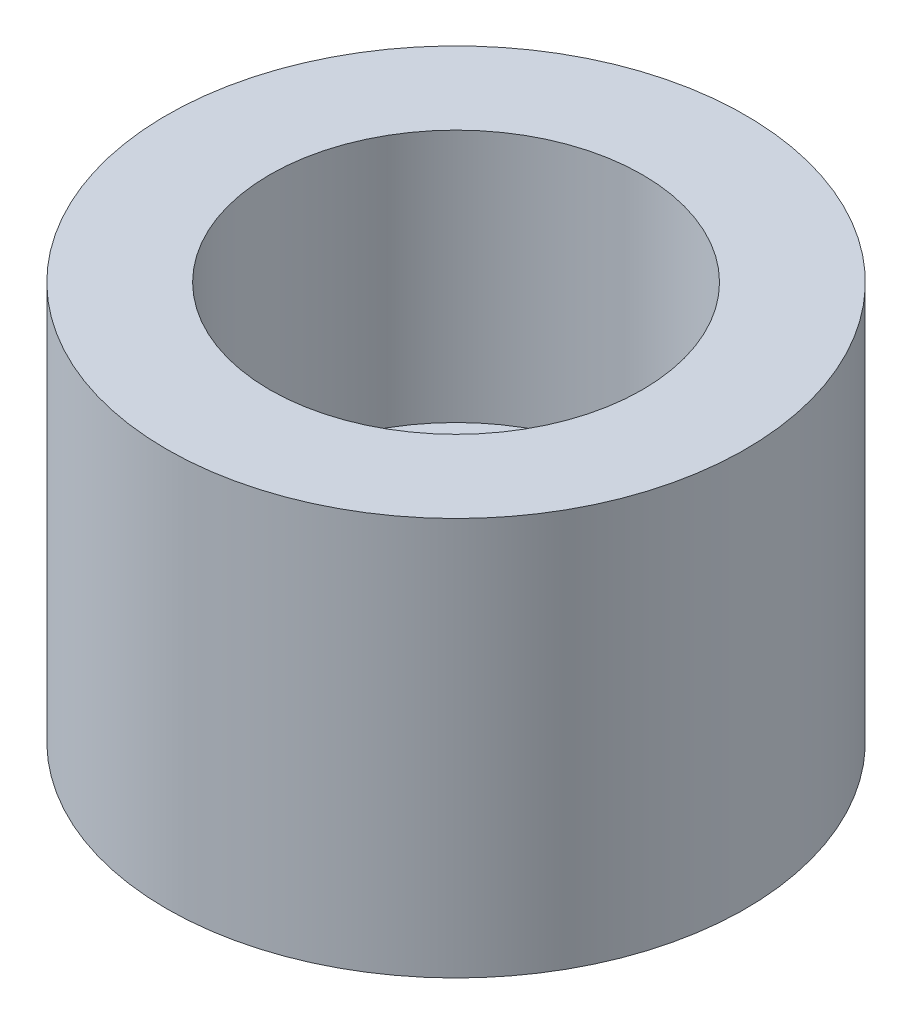
from build123d import *

# Parameters (mm, degrees)
SKETCH_1_R      = 8
SKETCH_1_R_2    = 1.65
EXTRUDE_1_DEPTH = 4
SKETCH_2_R      = 8
SKETCH_2_R_2    = 5.15
EXTRUDE_2_DEPTH = 7


with BuildPart() as part:
    # 草图1 → 凸台-拉伸1 (new body)
    with BuildSketch(Plane(origin=(0, 0, 0), x_dir=(1, 0, 0), z_dir=(0, 1, 0))):
        with Locations(Location((0, 0, 0), (0, 0, 270))):
            Circle(SKETCH_1_R)
        with Locations(Location((0, 0, 0), (0, 0, 270))):
            Circle(SKETCH_1_R_2, mode=Mode.SUBTRACT)
    extrude(amount=EXTRUDE_1_DEPTH)

    # 草图2 → 凸台-拉伸2 (add)
    with BuildSketch(Plane(origin=(0, 4, 0), x_dir=(1, 0, 0), z_dir=(0, 1, 0))):
        with Locations(Location((0, 0, 0), (0, 0, 270))):
            Circle(SKETCH_2_R)
        with Locations(Location((0, 0, 0), (0, 0, 270))):
            Circle(SKETCH_2_R_2, mode=Mode.SUBTRACT)
    extrude(amount=EXTRUDE_2_DEPTH)


solid = part.part
